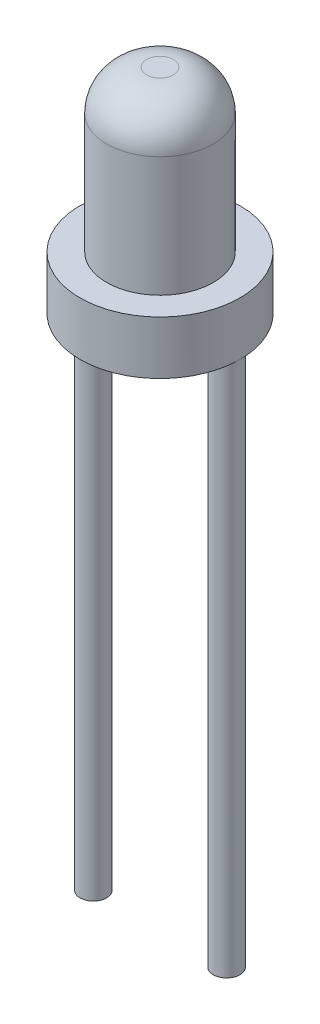
from build123d import *

# Parameters (mm, degrees)
ESBO_O2_R                = 0.25
RESSALTO_EXTRUS_O1_DEPTH = 10


with BuildPart() as part:
    # Esboço1 → Revolução1 (revolve)
    with BuildSketch(Plane.XY, mode=Mode.PRIVATE) as revolu_o1_sk:
        with BuildLine():
            Line((0, 4), (0.25, 4))
            ThreePointArc((0.25, 4), (0.780330086, 3.780330086), (1, 3.25))
            Line((1, 3.25), (1, 1))
            Line((1, 1), (1.5, 1))
            Line((1.5, 1), (1.5, 0))
            Line((1.5, 0), (0, 0))
            Line((0, 0), (0, 4))
        make_face()
    revolve(revolu_o1_sk.sketch.rotate(Axis((0, 0, 0), (0, 1, 0)), 90), axis=Axis((0, 0, 0), (0, 1, 0)))

    # Esboço2 → Ressalto-extrusão1 (add)
    with BuildSketch(Plane.XZ):
        with Locations(Location((-1.25, 0, 0), (0, 0, 179.998224755))):
            Circle(ESBO_O2_R)
        with Locations(Location((1.25, 0, 0), (0, 0, 90))):
            Circle(ESBO_O2_R)
    extrude(amount=RESSALTO_EXTRUS_O1_DEPTH)


solid = part.part
